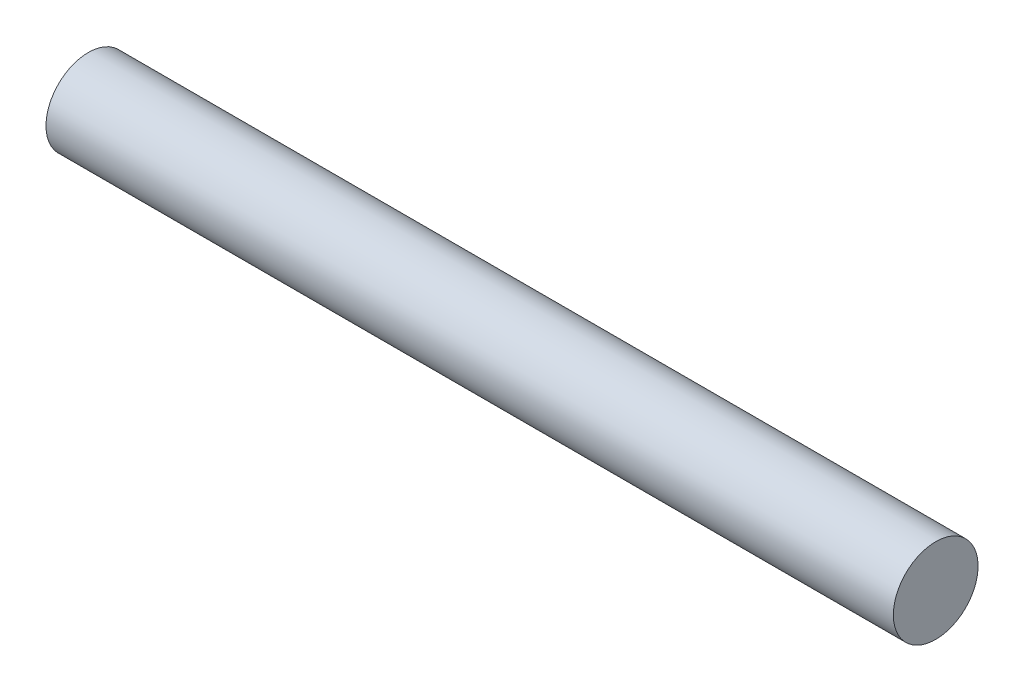
from build123d import *

# Parameters (mm, degrees)
SKETCH1_R           = 0.5
BOSS_EXTRUDE1_DEPTH = 10


with BuildPart() as part:
    # Sketch1 → Boss-Extrude1 (new body)
    with BuildSketch(Plane(origin=(0, 0, 0), x_dir=(0, 0, -1), z_dir=(1, 0, 0))):
        with Locations(Location((0, 0, 0), (0, 0, 180))):
            Circle(SKETCH1_R)
    extrude(amount=BOSS_EXTRUDE1_DEPTH)


solid = part.part
